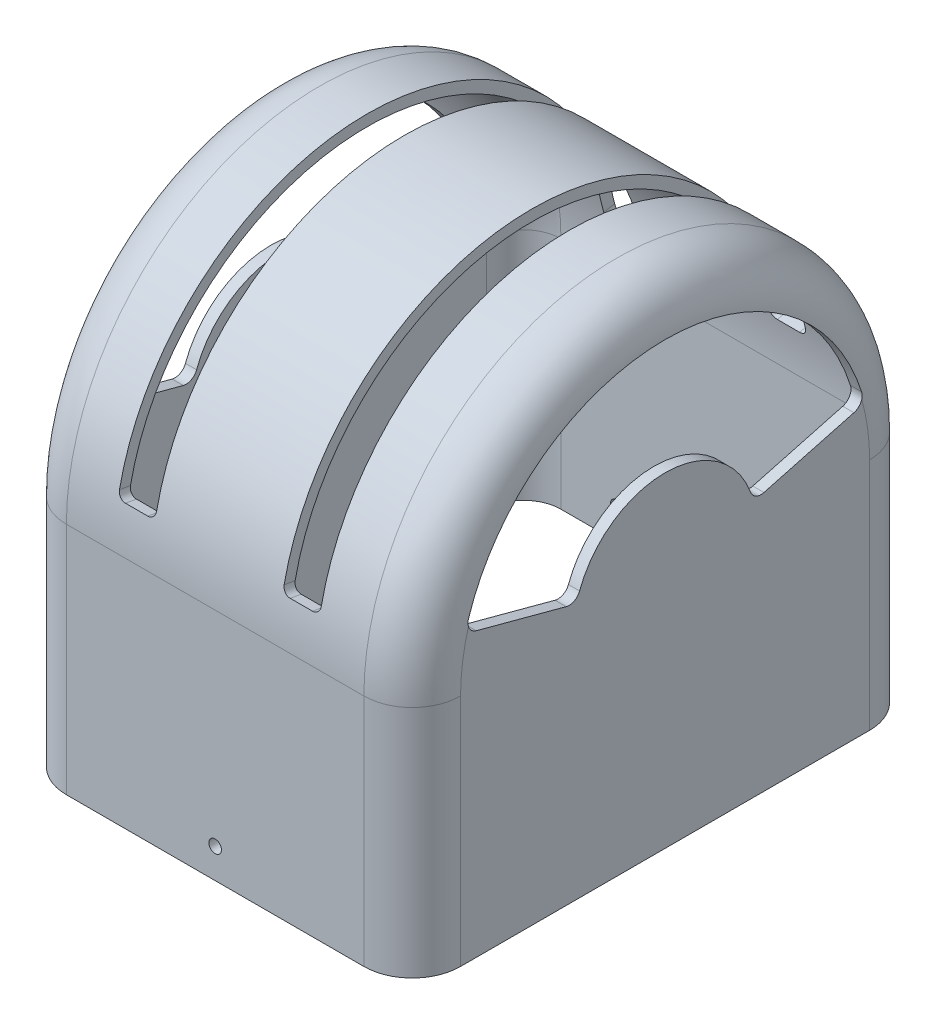
from build123d import *

# Parameters (mm, degrees)
BOSS_EXTRUDE1_DEPTH      = 53
BOSS_EXTRUDE1_DEPTH_BACK = 53
FILLET1_R                = 13
SHELL1_T                 = -3
CUT_EXTRUDE1_DEPTH       = 155.32757377
CUT_EXTRUDE1_DEPTH_BACK  = 155.32757377
CUT_EXTRUDE2_START       = -22.145
CUT_EXTRUDE2_DEPTH       = 5
FILLET2_R                = 2
SKETCH4_R                = 1.7
CUT_EXTRUDE3_DEPTH       = 10
SKETCH5_R                = 1.7
CUT_EXTRUDE6_DEPTH       = 10


with BuildPart() as part:
    # Sketch1 → Boss-Extrude1 (new, two sides: drawn at the far end of the back side and taken through both)
    with BuildSketch(Plane(origin=(0, -21.232774713, 56.11), x_dir=(0, -1, 0), z_dir=(-1, 0, 0)).offset(-BOSS_EXTRUDE1_DEPTH_BACK)):
        with BuildLine():
            Line((-18.232774713, -124.11), (-18.232774713, 11.89))
            Line((-18.232774713, 11.89), (-81.232774713, 11.89))
            ThreePointArc((-81.232774713, 11.89), (-149.232774713, -56.11), (-81.232774713, -124.11))
            Line((-81.232774713, -124.11), (-18.232774713, -124.11))
        make_face()
    extrude(amount=BOSS_EXTRUDE1_DEPTH + BOSS_EXTRUDE1_DEPTH_BACK)

    # Fillet1
    fillet1_edges = [part.edges().sort_by_distance(p)[0] for p in [
        (53, 28.5, 68),
        (53, 128, 0),
        (53, 28.5, -68),
        (-53, 28.5, 68),
        (-53, 28.5, -68),
        (-53, 128, 0),
    ]]
    fillet(fillet1_edges, radius=FILLET1_R)

    # Shell1
    shell1_openings = [part.faces().sort_by_distance(p)[0] for p in [
        (0, -3, 0),
    ]]
    offset(amount=SHELL1_T, openings=shell1_openings, kind=Kind.INTERSECTION)

    # Sketch2 → Cut-Extrude1 (cut, two sides: drawn at the far end of the back side and taken through both)
    with BuildSketch(Plane(origin=(0, 0, 0), x_dir=(0, 0, -1), z_dir=(1, 0, 0)).offset(-CUT_EXTRUDE1_DEPTH_BACK)):
        with BuildLine():
            Line((-26.582377719, 66.605088553), (-50.782987187, 73.089622316))
            ThreePointArc((-50.782987187, 73.089622316), (-52.639593743, 74.549701775), (-52.864046055, 76.900965497))
            ThreePointArc((-52.864046055, 76.900965497), (0, 115.5), (52.864046055, 76.900965497))
            ThreePointArc((52.864046055, 76.900965497), (52.639593743, 74.549701775), (50.782987187, 73.089622316))
            Line((50.782987187, 73.089622316), (26.582377719, 66.605088553))
            ThreePointArc((26.582377719, 66.605088553), (24.425691005, 66.839228235), (22.990729248, 68.466189737))
            ThreePointArc((22.990729248, 68.466189737), (0, 84.5), (-22.990729248, 68.466189737))
            ThreePointArc((-22.990729248, 68.466189737), (-24.425691005, 66.839228235), (-26.582377719, 66.605088553))
        make_face()
    extrude(amount=CUT_EXTRUDE1_DEPTH + CUT_EXTRUDE1_DEPTH_BACK, mode=Mode.SUBTRACT)

    # Sketch3 → Cut-Extrude2 (cut, symmetric)
    with BuildSketch(Plane(origin=(0, 0, 0), x_dir=(0, 0, -1), z_dir=(1, 0, 0)).offset(CUT_EXTRUDE2_START)):
        with BuildLine():
            Line((0, 60), (98.480775301, 77.364817767))
            ThreePointArc((98.480775301, 77.364817767), (0, 160), (-98.480775301, 77.364817767))
            Line((-98.480775301, 77.364817767), (0, 60))
        make_face()
    cut_extrude2 = extrude(amount=CUT_EXTRUDE2_DEPTH, both=True, mode=Mode.SUBTRACT)

    # Mirror1: Cut-Extrude2 across plane
    add(cut_extrude2.mirror(Plane(origin=(0, 0, 0), x_dir=(0, 0, 1), z_dir=(1, 0, 0))), mode=Mode.SUBTRACT)

    # Fillet2
    fillet2_edges = [part.edges().sort_by_distance(p)[0] for p in [
        (-17.145, 71.547603815, 65.489715575),
        (-17.145, 71.547603815, -65.489715575),
        (-27.145, 71.547603815, -65.489715575),
        (-27.145, 71.547603815, 65.489715575),
        (27.145, 71.547603815, 65.489715575),
        (27.145, 71.547603815, -65.489715575),
        (17.145, 71.547603815, -65.489715575),
        (17.145, 71.547603815, 65.489715575),
    ]]
    fillet(fillet2_edges, radius=FILLET2_R)

    # Sketch4 → Cut-Extrude3 (cut)
    with BuildSketch(Plane.XY.offset(68)):
        with Locations((0, 5)):
            Circle(SKETCH4_R)
    extrude(amount=-CUT_EXTRUDE3_DEPTH, mode=Mode.SUBTRACT)

    # Sketch5 → Cut-Extrude6 (cut)
    with BuildSketch(Plane(origin=(0, 0, -68), x_dir=(-1, 0, 0), z_dir=(0, 0, -1))):
        with Locations((25, 5)):
            Circle(SKETCH5_R)
        with Locations((-25, 5)):
            Circle(SKETCH5_R)
    extrude(amount=-CUT_EXTRUDE6_DEPTH, mode=Mode.SUBTRACT)


solid = part.part
